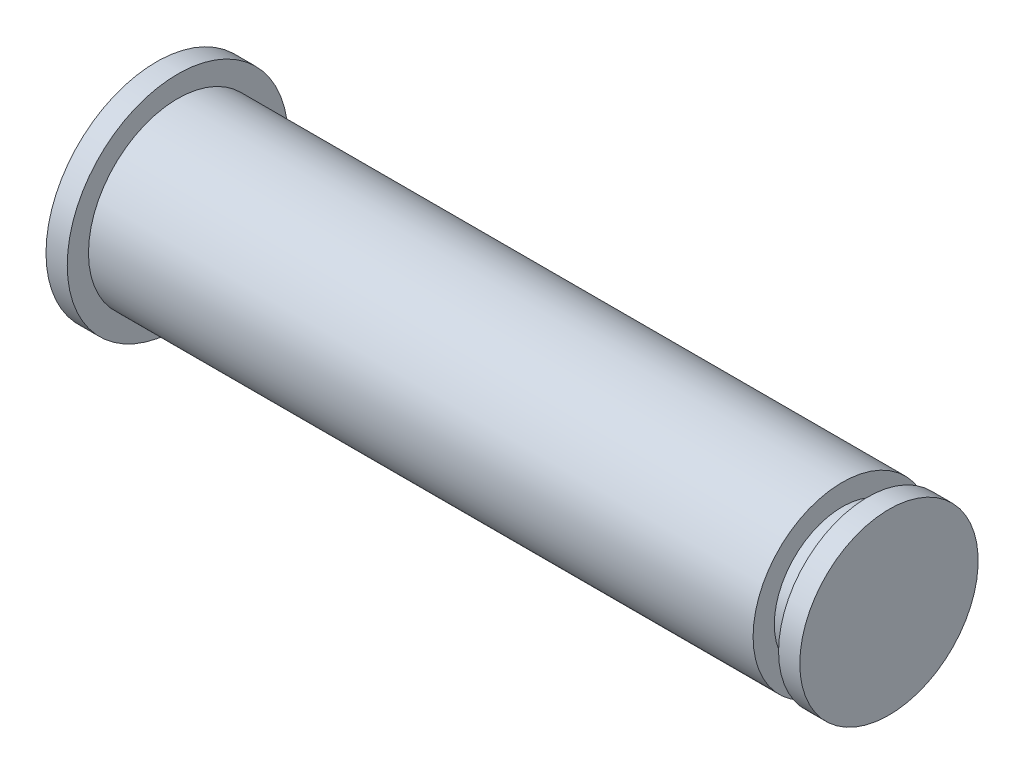
from build123d import *


with BuildPart() as part:
    # 草图1 → 旋转1 (revolve)
    with BuildSketch(Plane.XY, mode=Mode.PRIVATE) as revolve_1_sk:
        Polygon((32.3, 4.2), (1, 4.2), (1, 5.2), (0, 5.2), (0, 0), (34.5, 0), (34.5, 4.2), (33.5, 4.2), (33.5, 3.2), (32.3, 3.2), align=None)
    revolve(revolve_1_sk.sketch.rotate(Axis((0, 0, 0), (1, 0, 0)), 90), axis=Axis((0, 0, 0), (1, 0, 0)))


solid = part.part
